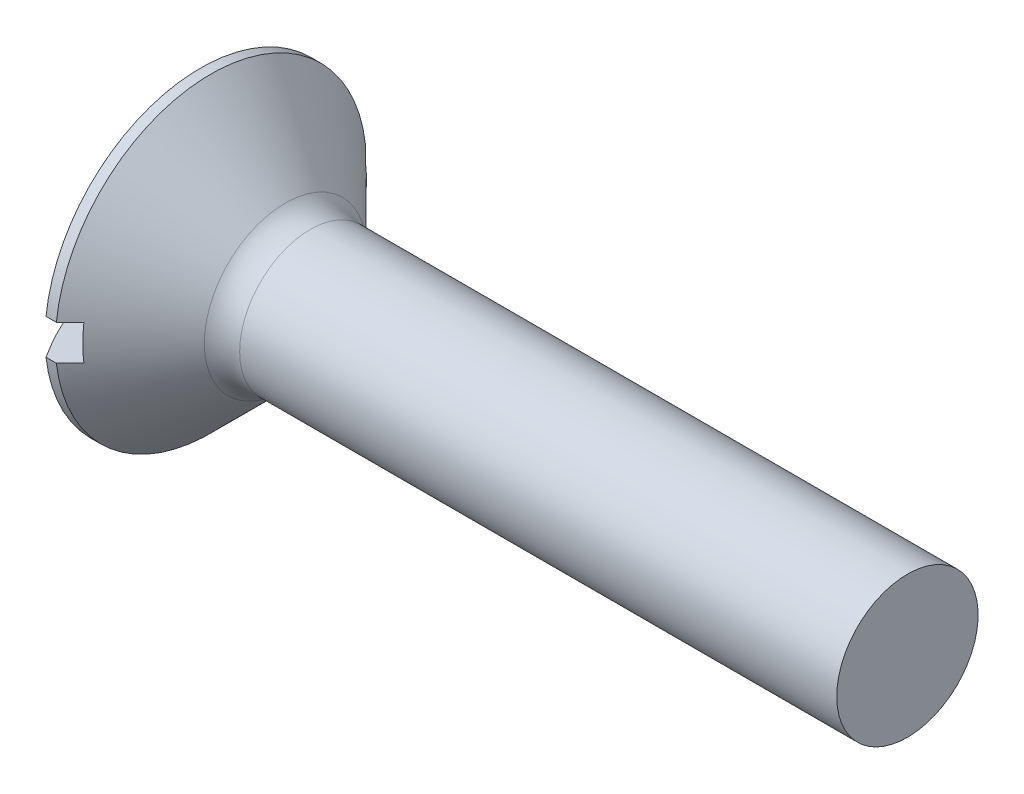
from build123d import *

# Parameters (mm, degrees)
SLOT_DEPTH      = 12.1041235
SLOT_DEPTH_BACK = 12.1041235
SKE_SLOT_W      = 1
SKE_SLOT_H      = 0.5


with BuildPart() as part:
    # Ske-Screw → Base (revolve)
    with BuildSketch(Plane.XY, mode=Mode.PRIVATE) as base_sk:
        with BuildLine():
            Line((0.659341382, 2.2), (0.805787992, 2.2))
            Line((0.805787992, 2.2), (1.859341382, 1.146446609))
            ThreePointArc((1.859341382, 1.146446609), (2.021553057, 1.038060234), (2.212894773, 1))
            Line((2.212894773, 1), (10.659341382, 1))
            Line((10.659341382, 1), (10.659341382, 0))
            Line((10.659341382, 0), (0.659341382, 0))
            Line((0.659341382, 0), (0, 0))
            ThreePointArc((0, 0), (0.168379294, 1.148339133), (0.659341382, 2.2))
        make_face()
    revolve(base_sk.sketch.rotate(Axis((-1.349906986, 0, 0), (1, 0, 0)), 90), axis=Axis((-1.349906986, 0, 0), (1, 0, 0)))

    # Ske-Slot → Slot (cut, two sides: drawn at the far end of the back side and taken through both)
    with BuildSketch(Plane.XY.offset(-SLOT_DEPTH_BACK)):
        with Locations((0.5, 0)):
            Rectangle(SKE_SLOT_W, SKE_SLOT_H)
    extrude(amount=SLOT_DEPTH + SLOT_DEPTH_BACK, mode=Mode.SUBTRACT)


solid = part.part
